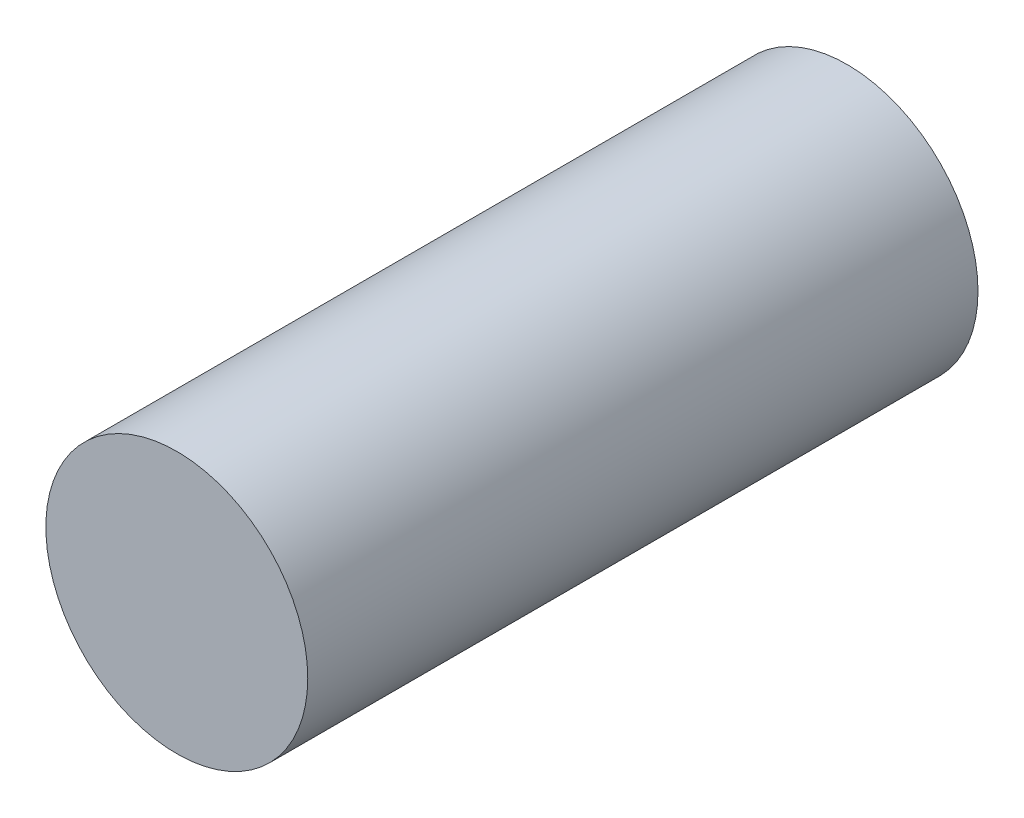
from build123d import *

# Parameters (mm, degrees)
ESBO_O1_R                = 12.7
RESSALTO_EXTRUS_O1_DEPTH = 65


with BuildPart() as part:
    # Esboço1 → Ressalto-extrusão1 (new body)
    with BuildSketch(Plane.XY):
        Circle(ESBO_O1_R)
    extrude(amount=RESSALTO_EXTRUS_O1_DEPTH)


solid = part.part
